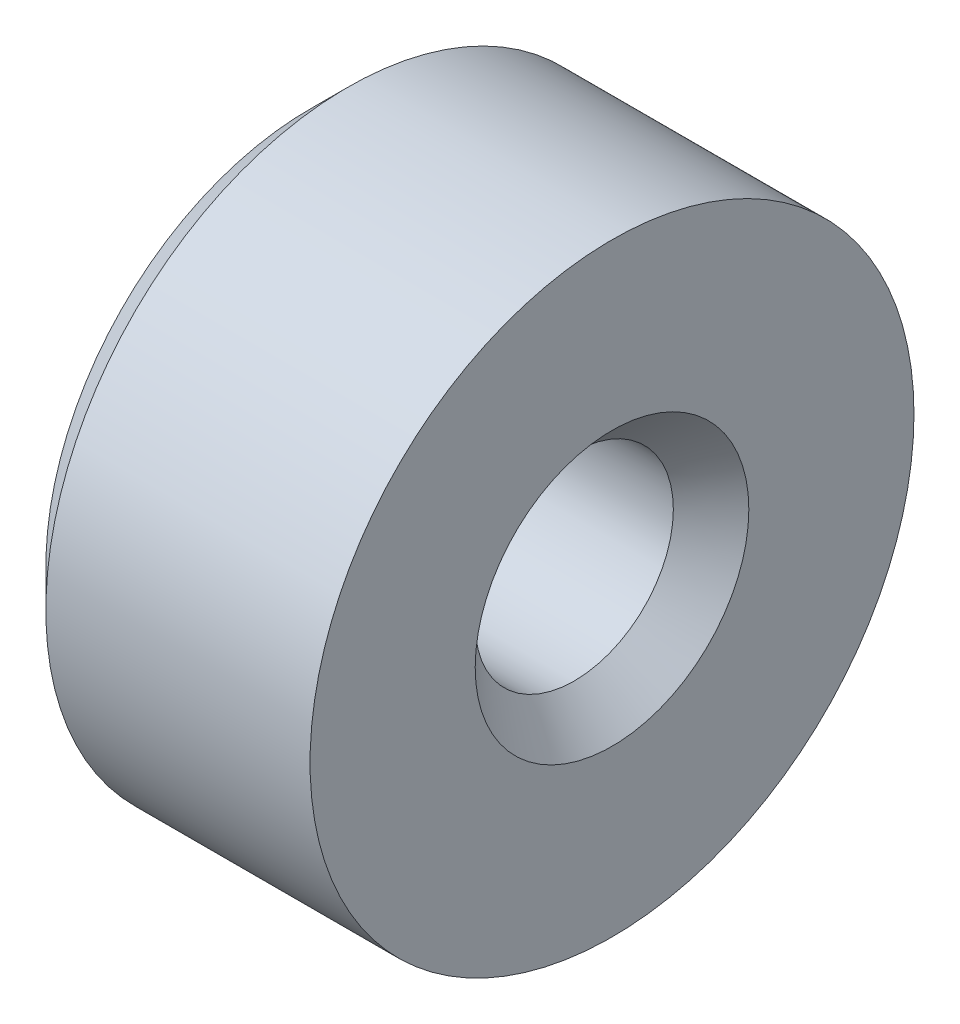
from build123d import *

# Parameters (mm, degrees)
SKETCH1_R           = 8
SKETCH1_R_2         = 2.625
BOSS_EXTRUDE1_DEPTH = 8
CHAMFER2_SIZE       = 1
CHAMFER3_SIZE       = 1


with BuildPart() as part:
    # Sketch1 → Boss-Extrude1 (new body)
    with BuildSketch(Plane(origin=(0, 0, 0), x_dir=(0, 0, -1), z_dir=(1, 0, 0))):
        Circle(SKETCH1_R)
        Circle(SKETCH1_R_2, mode=Mode.SUBTRACT)
    extrude(amount=BOSS_EXTRUDE1_DEPTH)

    # Chamfer2
    chamfer2_edges = [part.edges().sort_by_distance(p)[0] for p in [
        (8, 0, 2.625),
        (0, 0, 2.625),
    ]]
    chamfer(chamfer2_edges, length=CHAMFER2_SIZE)

    # Chamfer3
    chamfer3_edges = [part.edges().sort_by_distance(p)[0] for p in [
        (0, 0, 8),
    ]]
    chamfer(chamfer3_edges, length=CHAMFER3_SIZE)


solid = part.part
